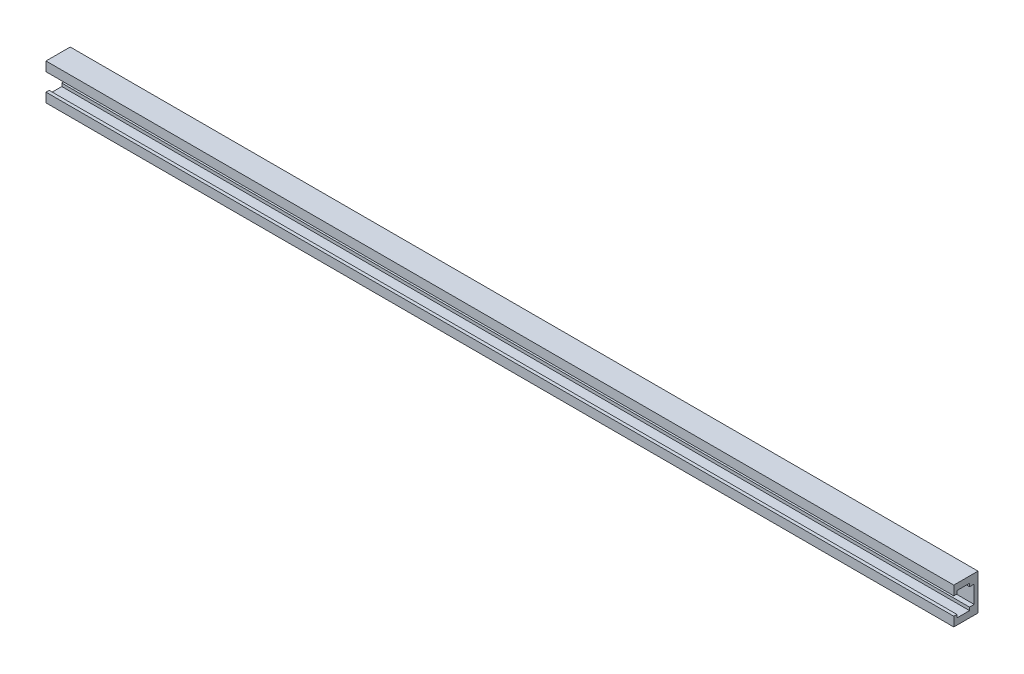
from build123d import *

# Parameters (mm, degrees)
BOSS_EXTRUDE1_DEPTH = 228.6
SKETCH3_R           = 2.413
CUT_EXTRUDE1_DEPTH  = 1.905
LPATTERN1_COUNT     = 3
LPATTERN1_PITCH     = 76.2


with BuildPart() as part:
    # Sketch2 → Boss-Extrude1 (new, symmetric)
    with BuildSketch(Plane(origin=(0, 0, 0), x_dir=(0, 0, -1), z_dir=(1, 0, 0))):
        Polygon((0, 9.144), (-12.192, 9.144), (-12.192, 4.445), (-10.6045, 4.445), (-10.6045, 5.969), (-4.2545, 5.969), (-4.2545, 4.445), (-1.905, 4.445), (-1.905, -4.445), (-4.2545, -4.445), (-4.2545, -5.969), (-10.6045, -5.969), (-10.6045, -4.445), (-12.192, -4.445), (-12.192, -9.144), (0, -9.144), align=None)
    extrude(amount=BOSS_EXTRUDE1_DEPTH, both=True)

    # Sketch3 → Cut-Extrude1 (cut)
    with BuildSketch(Plane.XY.offset(1.905)):
        with Locations((38.1, 0)):
            Circle(SKETCH3_R)
    cut_extrude1 = extrude(amount=-CUT_EXTRUDE1_DEPTH, mode=Mode.SUBTRACT)

    # LPattern1: Cut-Extrude1 ×3
    with Locations(*[(i * LPATTERN1_PITCH, 0, 0) for i in range(1, LPATTERN1_COUNT)]):
        add(cut_extrude1, mode=Mode.SUBTRACT)

    # SurfaceCut1
    split(bisect_by=Plane(origin=(0, 0, 0), x_dir=(0, 0, -1), z_dir=(1, 0, 0)), keep=Keep.TOP)

    # Mirror1: part across plane


with BuildPart() as part_1:
    add(part.part)
    add(part.part.mirror(Plane(origin=(0, 0, 0), x_dir=(0, 0, 1), z_dir=(1, 0, 0))))


solid = part_1.part
